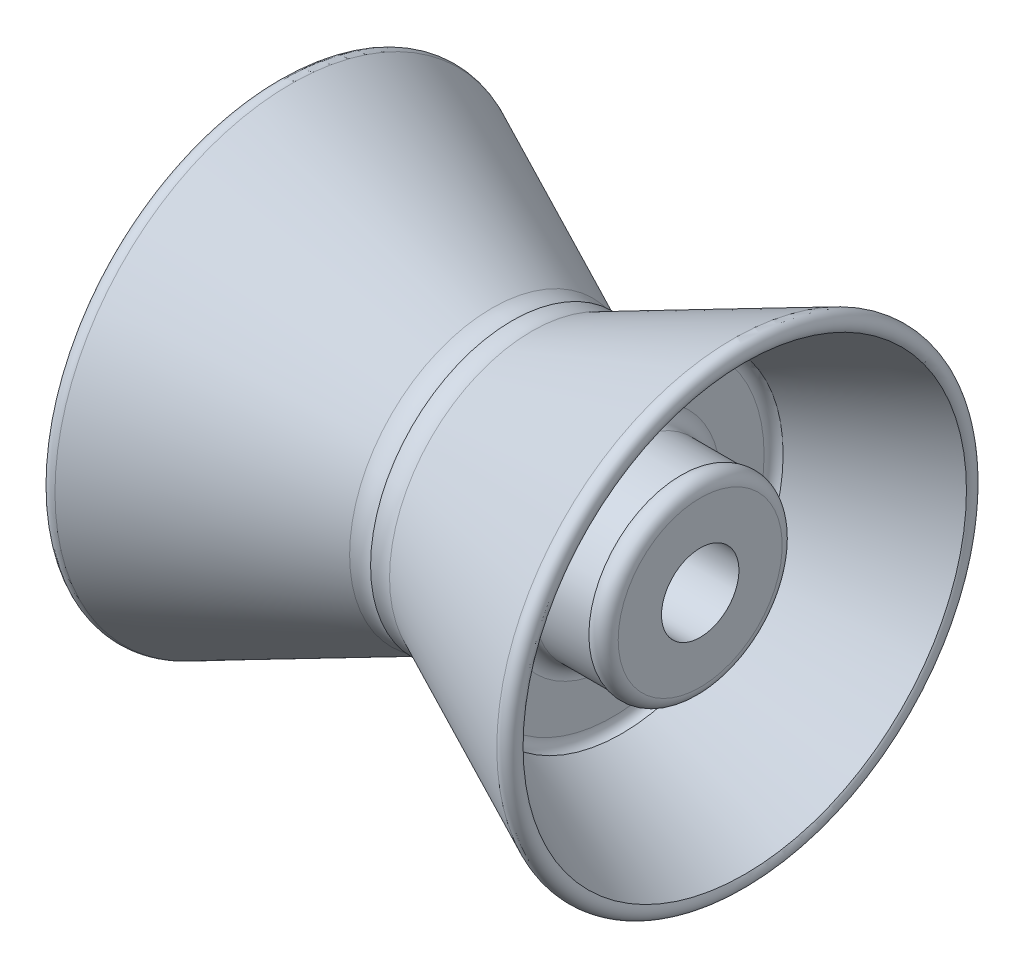
from build123d import *


with BuildPart() as part:
    # Sketch1 → Revolve2 (revolve)
    with BuildSketch(Plane(origin=(0, 0, 0), x_dir=(1, 0, 0), z_dir=(0, 1, 0)), mode=Mode.PRIVATE) as revolve2_sk:
        with BuildLine():
            Line((-89.945794133, 18.4958208), (-39.243365974, 18.4958208))
            Line((-39.243365974, 18.4958208), (-39.243365974, 50.641233934))
            ThreePointArc((-39.243365974, 50.641233934), (-37.010505257, 55.401054962), (-31.922873958, 56.726789087))
            Line((-31.922873958, 56.726789087), (-7.644544196, 45.405617992))
            ThreePointArc((-7.644544196, 45.405617992), (-3.774781621, 44.648749795), (0, 45.788458341))
            ThreePointArc((0, 45.788458341), (3.774781621, 44.648749795), (7.644544196, 45.405617992))
            Line((7.644544196, 45.405617992), (31.922873958, 56.726789087))
            ThreePointArc((31.922873958, 56.726789087), (37.010505257, 55.401054962), (39.243365974, 50.641233934))
            Line((39.243365974, 50.641233934), (39.243365974, 18.4958208))
            Line((39.243365974, 18.4958208), (89.945794133, 18.4958208))
            Line((89.945794133, 18.4958208), (89.945794133, 39.190116446))
            ThreePointArc((89.945794133, 39.190116446), (86.880932521, 44.355908205), (80.878184958, 44.141892074))
            Line((80.878184958, 44.141892074), (54.468714942, 44.141892074))
            ThreePointArc((54.468714942, 44.141892074), (49.567705941, 46.38926256), (48.072671422, 51.569555516))
            Line((48.072671422, 51.569555516), (48.072671422, 72.408277951))
            ThreePointArc((48.072671422, 72.408277951), (49.325225736, 75.628784108), (52.424586517, 77.156696072))
            Line((52.424586517, 77.156696072), (111.246164538, 105.95035301))
            ThreePointArc((111.246164538, 105.95035301), (111.085654842, 111.596200371), (105.57767883, 112.846622716))
            Line((105.57767883, 112.846622716), (9.542365686, 68.064620744))
            ThreePointArc((9.542365686, 68.064620744), (4.817880408, 66.892608341), (0, 67.587160426))
            ThreePointArc((0, 67.587160426), (-4.817880408, 66.892608341), (-9.542365686, 68.064620744))
            Line((-9.542365686, 68.064620744), (-105.57767883, 112.846622716))
            ThreePointArc((-105.57767883, 112.846622716), (-111.085654842, 111.596200371), (-111.246164538, 105.95035301))
            Line((-111.246164538, 105.95035301), (-52.424586517, 77.156696072))
            ThreePointArc((-52.424586517, 77.156696072), (-49.325225736, 75.628784108), (-48.072671422, 72.408277951))
            Line((-48.072671422, 72.408277951), (-48.072671422, 51.569555516))
            ThreePointArc((-48.072671422, 51.569555516), (-49.567705941, 46.38926256), (-54.468714942, 44.141892074))
            Line((-54.468714942, 44.141892074), (-80.878184958, 44.141892074))
            ThreePointArc((-80.878184958, 44.141892074), (-86.880932521, 44.355908205), (-89.945794133, 39.190116446))
            Line((-89.945794133, 39.190116446), (-89.945794133, 18.4958208))
        make_face()
    revolve(revolve2_sk.sketch.rotate(Axis((-137.857544933, 0, 0), (1, 0, 0)), 180), axis=Axis((-137.857544933, 0, 0), (1, 0, 0)))


solid = part.part
